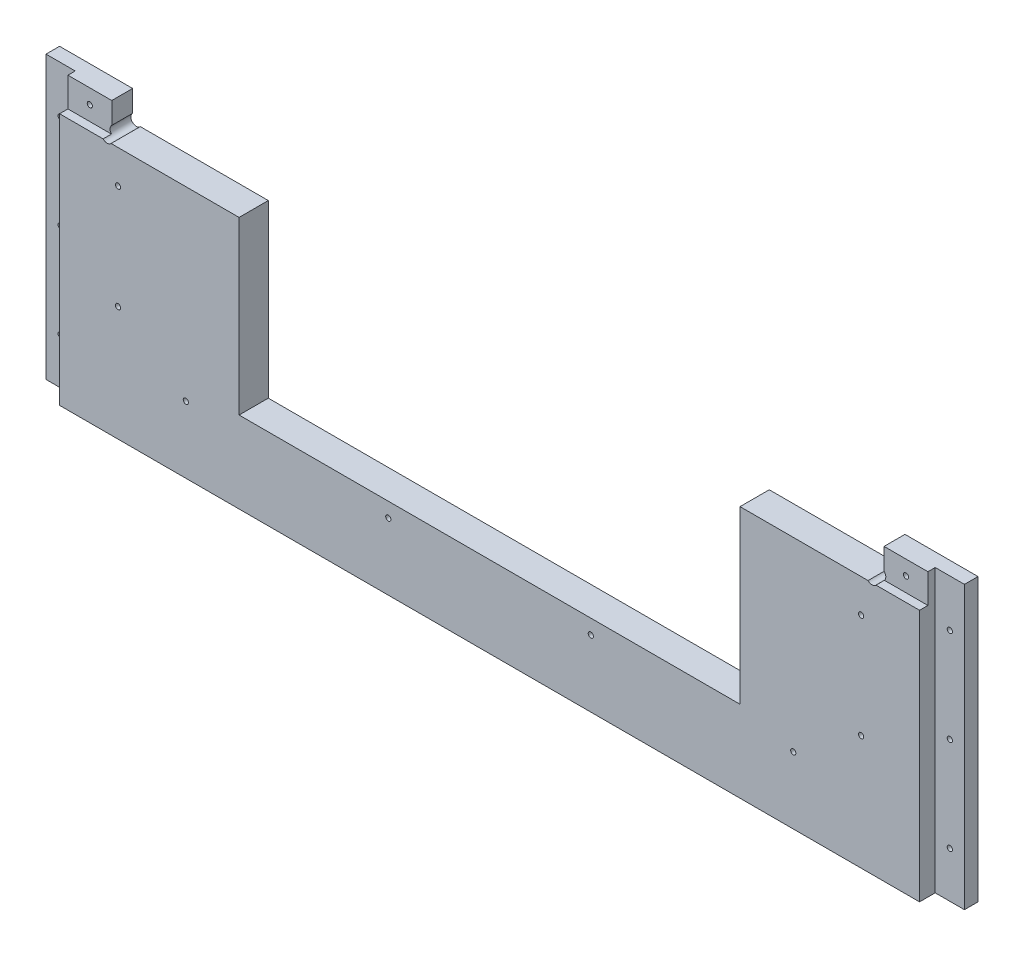
from build123d import *

# Parameters (mm, degrees)
EXTRUDE1_DEPTH     = 17.78
SKETCH3_W          = 44.45
SKETCH3_H          = 17.78
CUT_EXTRUDE1_DEPTH = 5.08
SKETCH4_W          = 17.78
SKETCH4_H          = 171.45
CUT_EXTRUDE2_DEPTH = 9.525
CUT_EXTRUDE3_START = -17.78
SKETCH5_R          = 1.5875
SKETCH5_R_2        = 3.302
CUT_EXTRUDE3_DEPTH = 17.78


with BuildPart() as part:
    # Sketch2 → Extrude1 (new body)
    with BuildSketch(Plane.XY):
        Polygon((12254.441666666, -6342.0625), (12254.441666666, -6170.6125), (12209.991666666, -6170.6125), (12209.991666666, -6188.3925), (12127.441666666, -6188.3925), (12127.441666666, -6292.5325), (11822.641666666, -6292.5325), (11822.641666666, -6188.3925), (11740.091666666, -6188.3925), (11740.091666666, -6170.6125), (11695.641666666, -6170.6125), (11695.641666666, -6342.0625), align=None)
    extrude(amount=-EXTRUDE1_DEPTH)

    # Sketch3 → Cut-Extrude1 (cut)
    with BuildSketch(Plane.XY):
        with Locations((11717.866666666, -6179.5025)):
            Rectangle(SKETCH3_W, SKETCH3_H)
        with Locations((12232.216666666, -6179.5025)):
            Rectangle(SKETCH3_W, SKETCH3_H)
    extrude(amount=-CUT_EXTRUDE1_DEPTH, mode=Mode.SUBTRACT)

    # Sketch4 → Cut-Extrude2 (cut)
    with BuildSketch(Plane.XY):
        with Locations((11704.531666666, -6256.3375)):
            Rectangle(SKETCH4_W, SKETCH4_H)
        with Locations((12245.551666666, -6256.3375)):
            Rectangle(SKETCH4_W, SKETCH4_H)
    extrude(amount=-CUT_EXTRUDE2_DEPTH, mode=Mode.SUBTRACT)

    # Sketch5 → Cut-Extrude3 (cut)
    with BuildSketch(Plane.XY.offset(CUT_EXTRUDE3_START)):
        with Locations((11704.531666666, -6314.148958334)):
            Circle(SKETCH5_R)
        with Locations((11704.531666666, -6256.734375)):
            Circle(SKETCH5_R)
        with Locations((11704.531666666, -6199.319791666)):
            Circle(SKETCH5_R)
        with Locations((11726.756666666, -6179.5025)):
            Circle(SKETCH5_R)
        with Locations((11748.981666666, -6208.7125)):
            Circle(SKETCH5_R)
        with Locations((11748.981666666, -6272.2125)):
            Circle(SKETCH5_R)
        with Locations((11790.256666666, -6301.4225)):
            Circle(SKETCH5_R)
        with Locations((11913.446666666, -6301.4225)):
            Circle(SKETCH5_R)
        with Locations((12036.636666666, -6301.4225)):
            Circle(SKETCH5_R)
        with Locations((12159.826666666, -6301.4225)):
            Circle(SKETCH5_R)
        with Locations((12245.551666666, -6314.148958334)):
            Circle(SKETCH5_R)
        with Locations((12245.551666666, -6256.734375)):
            Circle(SKETCH5_R)
        with Locations((12201.101666666, -6272.2125)):
            Circle(SKETCH5_R)
        with Locations((12201.101666666, -6208.7125)):
            Circle(SKETCH5_R)
        with Locations((12245.551666666, -6199.319791666)):
            Circle(SKETCH5_R)
        with Locations((12223.326666666, -6179.5025)):
            Circle(SKETCH5_R)
        with Locations((11742.336730696, -6186.14743597)):
            Circle(SKETCH5_R_2)
        with Locations((12207.746602636, -6186.14743597)):
            Circle(SKETCH5_R_2)
    extrude(amount=CUT_EXTRUDE3_DEPTH, mode=Mode.SUBTRACT)


solid = part.part
